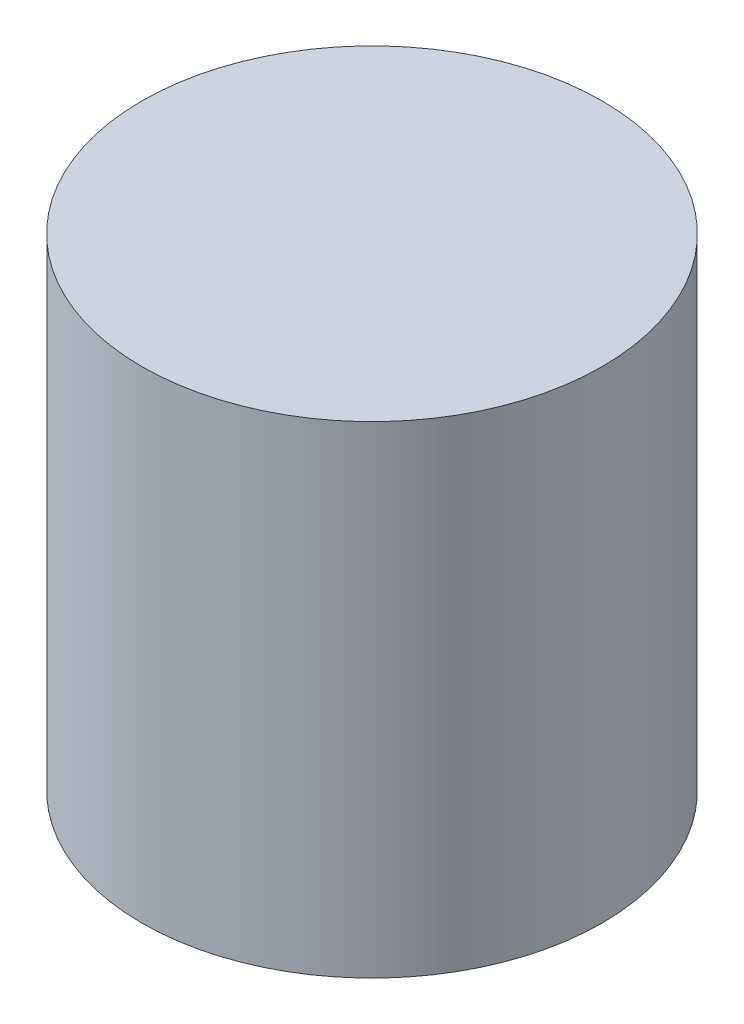
from build123d import *

# Parameters (mm, degrees)
SKETCH1_R           = 4.775
BOSS_EXTRUDE1_DEPTH = 5


with BuildPart() as part:
    # Sketch1 → Boss-Extrude1 (new, symmetric)
    with BuildSketch(Plane(origin=(0, 0, 0), x_dir=(1, 0, 0), z_dir=(0, 1, 0))):
        with Locations(Location((0, 0, 0), (0, 0, 270))):
            Circle(SKETCH1_R)
    extrude(amount=BOSS_EXTRUDE1_DEPTH, both=True)


solid = part.part
